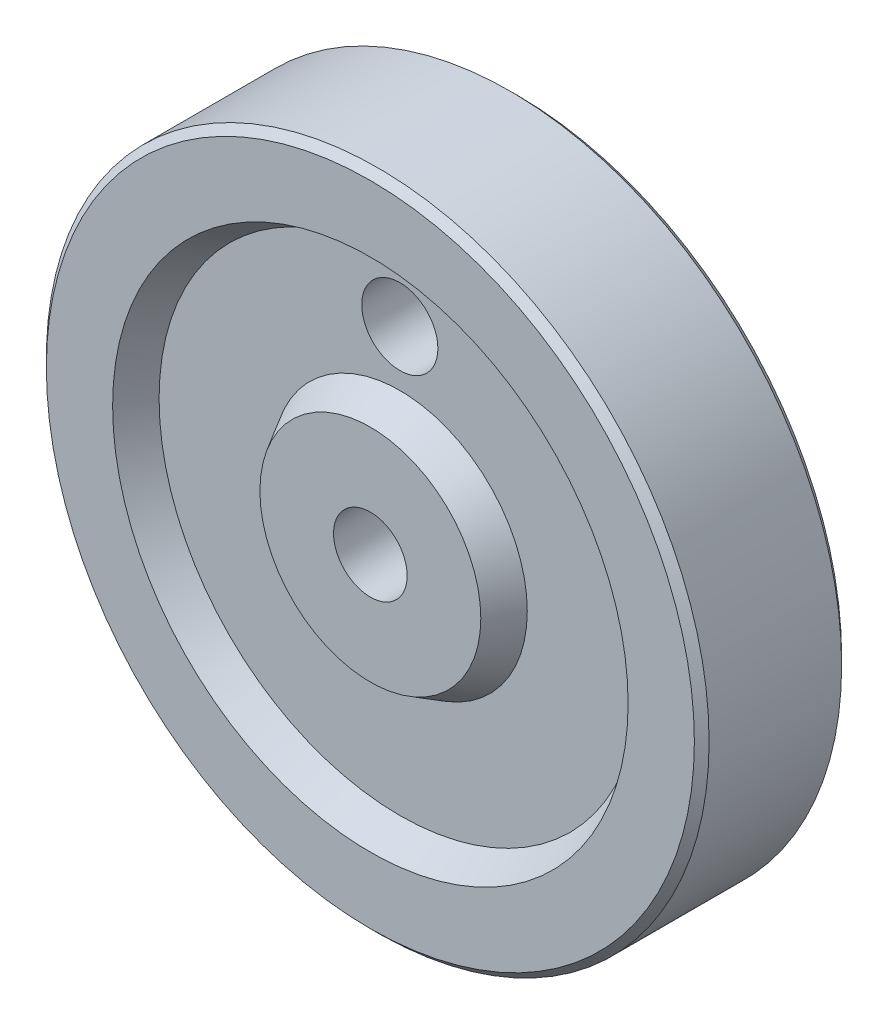
from build123d import *

# Parameters (mm, degrees)
SKETCH_1_R                 = 225
EXTRUDE_1_DEPTH            = 50
SKETCH_2_R                 = 25
CUT_EXTRUDE_1_DEPTH        = 334.541601603
SKETCH_3_R                 = 175
SKETCH_3_R_2               = 75
CUT_EXTRUDE_3_DEPTH        = 20
CUT_EXTRUDE_3_DRAFT        = -30
MIRROR_1_COPY_1_SKETCH_R   = 175
MIRROR_1_COPY_1_SKETCH_R_2 = 75
MIRROR_1_COPY_1_DEPTH      = 20
MIRROR_1_COPY_1_DRAFT      = -30
CHAMFER_1_SIZE             = 5
SKETCH_4_R                 = 25.852351377
CUT_EXTRUDE_4_DEPTH        = 329.10059433


with BuildPart() as part:
    # 草图1 → 凸台-拉伸1 (new, symmetric)
    with BuildSketch(Plane.XY):
        Circle(SKETCH_1_R)
    extrude(amount=EXTRUDE_1_DEPTH, both=True)

    # 草图2 → 切除-拉伸1 (cut, through all)
    with BuildSketch(Plane.XY.offset(50)):
        Circle(SKETCH_2_R)
    extrude(amount=-CUT_EXTRUDE_1_DEPTH, mode=Mode.SUBTRACT)


with BuildPart() as cut_extrude_3_tool:
    # 草图3 → 切除-拉伸3 (with draft: the straight prism first)
    with BuildSketch(Plane.XY.offset(50)):
        Circle(SKETCH_3_R)
        Circle(SKETCH_3_R_2, mode=Mode.SUBTRACT)
    extrude(amount=-CUT_EXTRUDE_3_DEPTH)
    # 切除-拉伸3: the draft: its side faces are tilted about the plane it starts from
    cut_extrude_3_sides = [cut_extrude_3_tool.faces().sort_by_distance(p)[0] for p in [
        (-175, 0, 40),
        (-75, 0, 40),
    ]]
    draft(cut_extrude_3_sides, Plane.XY.offset(50), CUT_EXTRUDE_3_DRAFT)


with BuildPart() as part_1:
    add(part.part)

    # 切除-拉伸3: cut by cut_extrude_3_tool
    add(cut_extrude_3_tool.part, mode=Mode.SUBTRACT)


with BuildPart() as mirror_1_copy_1_tool:
    # 镜向1 copy 1 sketch → 镜向1 copy 1 (with draft: the straight prism first)
    with BuildSketch(Plane(origin=(0, 0, -50), x_dir=(1, 0, 0), z_dir=(0, 0, -1))):
        Circle(MIRROR_1_COPY_1_SKETCH_R)
        Circle(MIRROR_1_COPY_1_SKETCH_R_2, mode=Mode.SUBTRACT)
    extrude(amount=-MIRROR_1_COPY_1_DEPTH)
    # 镜向1 copy 1: the draft: its side faces are tilted about the plane it starts from
    mirror_1_copy_1_sides = [mirror_1_copy_1_tool.faces().sort_by_distance(p)[0] for p in [
        (-175, 0, -40),
        (-75, 0, -40),
    ]]
    draft(mirror_1_copy_1_sides, Plane(origin=(0, 0, -50), x_dir=(1, 0, 0), z_dir=(0, 0, -1)), MIRROR_1_COPY_1_DRAFT)


with BuildPart() as part_2:
    add(part_1.part)

    # 镜向1 copy 1: cut by mirror_1_copy_1_tool
    add(mirror_1_copy_1_tool.part, mode=Mode.SUBTRACT)

    # 倒角1
    chamfer_1_edges = [part_2.edges().sort_by_distance(p)[0] for p in [
        (-225, 0, -50),
        (-225, 0, 50),
    ]]
    chamfer(chamfer_1_edges, length=CHAMFER_1_SIZE)

    # 草图4 → 切除-拉伸4 (cut, through all)
    with BuildSketch(Plane.XY.offset(30)):
        with Locations((0, 124.095015256)):
            Circle(SKETCH_4_R)
    extrude(amount=-CUT_EXTRUDE_4_DEPTH, mode=Mode.SUBTRACT)


solid = part_2.part
